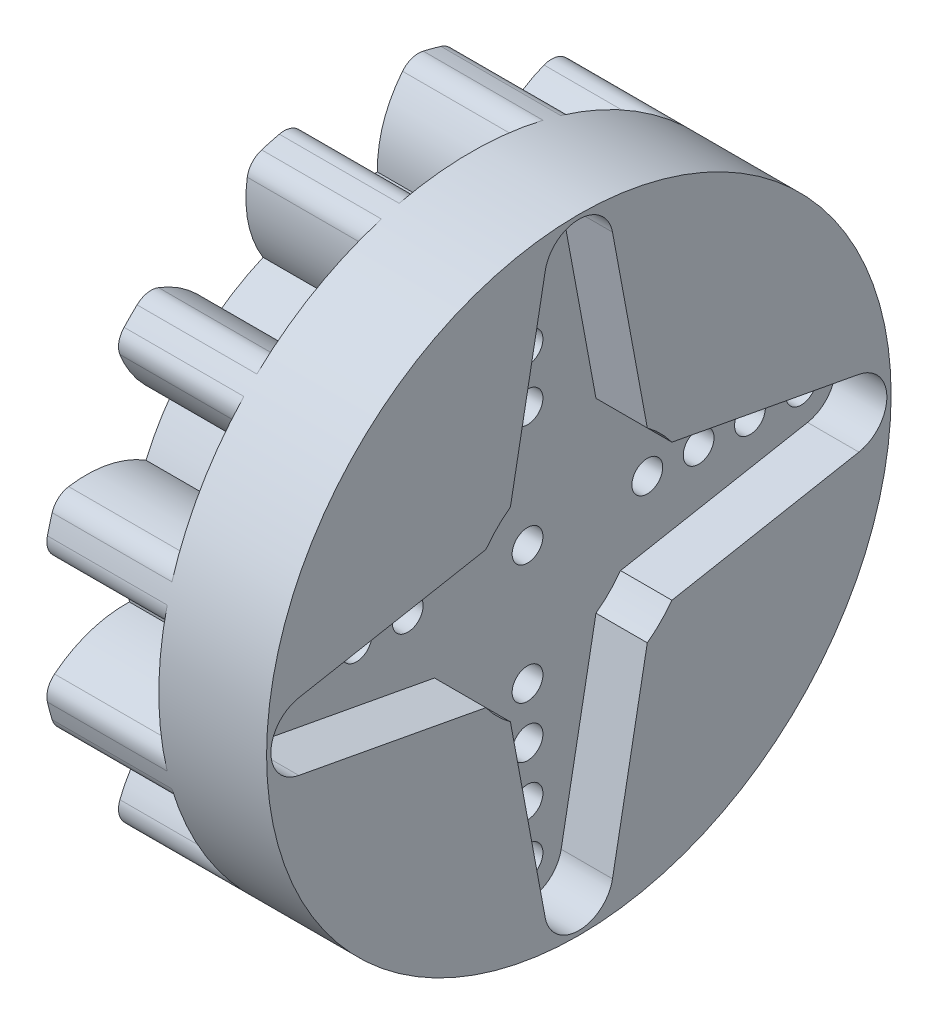
from build123d import *

# Parameters (mm, degrees)
BASPROSKE_W           = 7
BASPROSKE_H           = 19.25
TOOTHCUT_DEPTH        = 29.109162207
TEETHCUTS_COUNT       = 12
TEETHCUTS_ANGLE       = 330
BORSKE_R              = 0.4
BORE_DEPTH            = 50.0000508
EXTRUDE_START         = 6.3
SKETCH_1_R            = 18.5
SKETCH_1_R_2          = 0.4
EXTRUDE_1_DEPTH       = 6.3
SKETCH_13_OUTSIDE_W   = 50.348
SKETCH_13_OUTSIDE_H   = 50.348
SKETCH_13_OUTSIDE_R   = 18.25
SKETCH_13_OUTSIDE_R_2 = 0.9
CUT_EXTRUDE_11_DEPTH  = 30.621500794
FILLET_1_R            = 1.2
SKETCH_14_R           = 0.9
CUT_EXTRUDE_12_DEPTH  = 3
SKETCH_14_3_R         = 0.9
CUT_EXTRUDE_13_DEPTH  = 5


with BuildPart() as part:
    # BasProSke → Base-Revolve (revolve)
    with BuildSketch(Plane(origin=(0, 0, 0), x_dir=(1, 0, 0), z_dir=(0, 1, 0))):
        with Locations((3.5, 9.625)):
            Rectangle(BASPROSKE_W, BASPROSKE_H)
    revolve(axis=Axis((-10, 0, 0), (1, 0, 0)))

    # TooCutSke → ToothCut (cut, through all)
    with BuildSketch(Plane(origin=(0, 0, 0), x_dir=(0, 0, -1), z_dir=(1, 0, 0))):
        with BuildLine():
            ThreePointArc((1.535617211, 12.970916006), (0, 13.0615), (-1.535617211, 12.970916006))
            ThreePointArc((-1.535617211, 12.970916006), (-2.27635986, 16.247221969), (-4.533719407, 18.734631928))
            ThreePointArc((-4.533719407, 18.734631928), (0, 19.2754), (4.533719407, 18.734631928))
            ThreePointArc((4.533719407, 18.734631928), (2.27635986, 16.247221969), (1.535617211, 12.970916006))
        make_face()
    toothcut = extrude(amount=TOOTHCUT_DEPTH, mode=Mode.SUBTRACT)

    # TeethCuts: ToothCut ×12 about axis
    teethcuts_axis = Axis((-10, 0, 0), (1, 0, 0))
    for i in range(1, TEETHCUTS_COUNT):
        add(toothcut.rotate(teethcuts_axis, i * TEETHCUTS_ANGLE / (TEETHCUTS_COUNT - 1)), mode=Mode.SUBTRACT)

    # BorSke → Bore (cut, symmetric)
    with BuildSketch(Plane(origin=(0, 0, 0), x_dir=(0, 0, -1), z_dir=(1, 0, 0))):
        Circle(BORSKE_R)
    extrude(amount=BORE_DEPTH, both=True, mode=Mode.SUBTRACT)

    # Эскиз1 → Бобышка-Вытянуть1 (add)
    with BuildSketch(Plane(origin=(7, 0, 0), x_dir=(0, 0, -1), z_dir=(1, 0, 0)).offset(EXTRUDE_START)):
        Circle(SKETCH_1_R)
        Circle(SKETCH_1_R_2, mode=Mode.SUBTRACT)
    extrude(amount=-EXTRUDE_1_DEPTH)

    # Эскиз13 outside → Вырез-Вытянуть11 (cut, through all)
    # profile 1 of 2: a face of its own
    with BuildSketch(Plane(origin=(13.3, 0, 0), x_dir=(0, 0, -1), z_dir=(1, 0, 0))):
        Rectangle(SKETCH_13_OUTSIDE_W, SKETCH_13_OUTSIDE_H)
        Circle(SKETCH_13_OUTSIDE_R, mode=Mode.SUBTRACT)
    # profile 2 of 2: a face of its own
    with BuildSketch(Plane(origin=(13.3, 0, 0), x_dir=(0, 0, -1), z_dir=(1, 0, 0))):
        Circle(SKETCH_13_OUTSIDE_R_2)
    extrude(amount=-CUT_EXTRUDE_11_DEPTH, mode=Mode.SUBTRACT)

    # Скругление1
    fillet_1_edges = [part.edges().sort_by_distance(p)[0] for p in [
        (3.5, -5.918184945, -17.263765144),
        (3.5, -3.506584065, -17.909951652),
        (3.5, 3.506584065, -17.909951652),
        (3.5, 5.918184945, -17.263765144),
        (3.5, 11.991766707, -13.757181079),
        (3.5, 13.757181079, -11.991766707),
        (3.5, 17.263765144, -5.918184945),
        (3.5, 17.909951652, -3.506584065),
        (3.5, 17.263765144, 5.918184945),
        (3.5, 17.909951652, 3.506584065),
        (3.5, 13.757181079, 11.991766707),
        (3.5, 11.991766707, 13.757181079),
        (3.5, 5.918184945, 17.263765144),
        (3.5, 3.506584065, 17.909951652),
        (3.5, -3.506584065, 17.909951652),
        (3.5, -5.918184945, 17.263765144),
        (3.5, -11.991766707, 13.757181079),
        (3.5, -13.757181079, 11.991766707),
        (3.5, -17.263765144, 5.918184945),
        (3.5, -17.909951652, 3.506584065),
        (3.5, -17.909951652, -3.506584065),
        (3.5, -17.263765144, -5.918184945),
        (3.5, -11.991766707, -13.757181079),
        (3.5, -13.757181079, -11.991766707),
    ]]
    fillet(fillet_1_edges, radius=FILLET_1_R)

    # Эскиз14 → Вырез-Вытянуть12 (cut)
    with BuildSketch(Plane(origin=(13.3, 0, 0), x_dir=(0, 0, -1), z_dir=(1, 0, 0))):
        with BuildLine():
            ThreePointArc((1.966243984, 16.365902438), (0, 18), (-1.966243984, 16.365902438))
            Line((-1.966243984, 16.365902438), (-4, 5.437140793))
            ThreePointArc((-4, 5.437140793), (-4.772970773, 4.772970773), (-5.437140793, 4))
            Line((-5.437140793, 4), (-16.365902438, 1.966243984))
            ThreePointArc((-16.365902438, 1.966243984), (-18, 0), (-16.365902438, -1.966243984))
            Line((-16.365902438, -1.966243984), (-5.437140793, -4))
            ThreePointArc((-5.437140793, -4), (-4.772970773, -4.772970773), (-4, -5.437140793))
            Line((-4, -5.437140793), (-1.966243984, -16.365902438))
            ThreePointArc((-1.966243984, -16.365902438), (0, -18), (1.966243984, -16.365902438))
            Line((1.966243984, -16.365902438), (4, -5.437140793))
            ThreePointArc((4, -5.437140793), (4.772970773, -4.772970773), (5.437140793, -4))
            Line((5.437140793, -4), (16.365902438, -1.966243984))
            ThreePointArc((16.365902438, -1.966243984), (18, 0), (16.365902438, 1.966243984))
            Line((16.365902438, 1.966243984), (5.437140793, 4))
            ThreePointArc((5.437140793, 4), (4.772970773, 4.772970773), (4, 5.437140793))
            Line((4, 5.437140793), (1.966243984, 16.365902438))
        make_face()
        with Locations((0, 7)):
            Circle(SKETCH_14_R, mode=Mode.SUBTRACT)
        with Locations((0, 10)):
            Circle(SKETCH_14_R, mode=Mode.SUBTRACT)
        with Locations((0, 13)):
            Circle(SKETCH_14_R, mode=Mode.SUBTRACT)
        with Locations((0, 16)):
            Circle(SKETCH_14_R, mode=Mode.SUBTRACT)
        Circle(SKETCH_14_R, mode=Mode.SUBTRACT)
        with Locations((7, 0)):
            Circle(SKETCH_14_R, mode=Mode.SUBTRACT)
        with Locations((0, -7)):
            Circle(SKETCH_14_R, mode=Mode.SUBTRACT)
        with Locations((-7, 0)):
            Circle(SKETCH_14_R, mode=Mode.SUBTRACT)
        with Locations((13, 0)):
            Circle(SKETCH_14_R, mode=Mode.SUBTRACT)
        with Locations((16, 0)):
            Circle(SKETCH_14_R, mode=Mode.SUBTRACT)
        with Locations((10, 0)):
            Circle(SKETCH_14_R, mode=Mode.SUBTRACT)
        with Locations((0, -16)):
            Circle(SKETCH_14_R, mode=Mode.SUBTRACT)
        with Locations((0, -13)):
            Circle(SKETCH_14_R, mode=Mode.SUBTRACT)
        with Locations((0, -10)):
            Circle(SKETCH_14_R, mode=Mode.SUBTRACT)
        with Locations((-16, 0)):
            Circle(SKETCH_14_R, mode=Mode.SUBTRACT)
        with Locations((-13, 0)):
            Circle(SKETCH_14_R, mode=Mode.SUBTRACT)
        with Locations((-10, 0)):
            Circle(SKETCH_14_R, mode=Mode.SUBTRACT)
    extrude(amount=-CUT_EXTRUDE_12_DEPTH, mode=Mode.SUBTRACT)

    # Эскиз14<3> → Вырез-Вытянуть13 (cut)
    with BuildSketch(Plane(origin=(13.3, 0, 0), x_dir=(0, 0, -1), z_dir=(1, 0, 0))):
        with Locations((0, 7)):
            Circle(SKETCH_14_3_R)
        with Locations((-7, 0)):
            Circle(SKETCH_14_3_R)
        with Locations((7, 0)):
            Circle(SKETCH_14_3_R)
        with Locations((0, -7)):
            Circle(SKETCH_14_3_R)
        with Locations((0, 16)):
            Circle(SKETCH_14_3_R)
        with Locations((0, 13)):
            Circle(SKETCH_14_3_R)
        with Locations((0, 10)):
            Circle(SKETCH_14_3_R)
        with Locations((16, 0)):
            Circle(SKETCH_14_3_R)
        with Locations((13, 0)):
            Circle(SKETCH_14_3_R)
        with Locations((10, 0)):
            Circle(SKETCH_14_3_R)
        with Locations((0, -16)):
            Circle(SKETCH_14_3_R)
        with Locations((0, -13)):
            Circle(SKETCH_14_3_R)
        with Locations((0, -10)):
            Circle(SKETCH_14_3_R)
        with Locations((-16, 0)):
            Circle(SKETCH_14_3_R)
        with Locations((-13, 0)):
            Circle(SKETCH_14_3_R)
        with Locations((-10, 0)):
            Circle(SKETCH_14_3_R)
    extrude(amount=-CUT_EXTRUDE_13_DEPTH, mode=Mode.SUBTRACT)


solid = part.part
